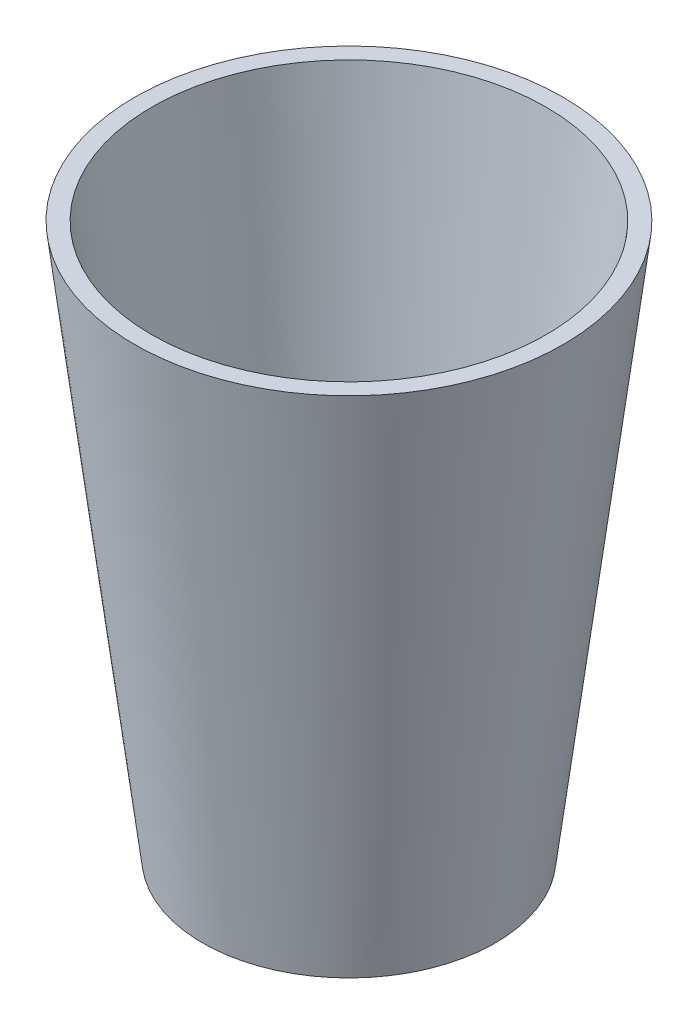
from build123d import *


with BuildPart() as part:
    # 草图2 → 旋转1 (revolve)
    with BuildSketch(Plane.XY, mode=Mode.PRIVATE) as revolve_1_sk:
        Polygon((0, 0), (23.335466714, 0), (35, 95), (38.022529476, 95), (25.989642508, -3), (0, -3), align=None)
    revolve(revolve_1_sk.sketch.rotate(Axis((0, 0, 0), (0, 1, 0)), 90), axis=Axis((0, 0, 0), (0, 1, 0)))


solid = part.part
